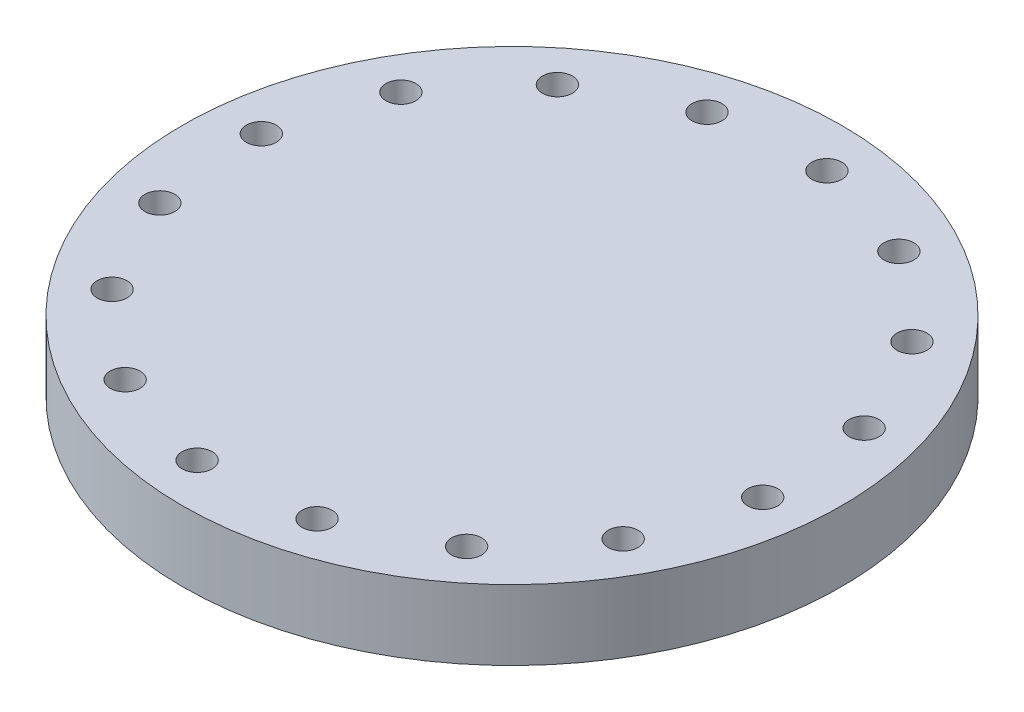
from build123d import *

# Parameters (mm, degrees)
SKETCH1_R           = 27.5
BOSS_EXTRUDE1_DEPTH = 2.925
CUT_EXTRUDE1_DEPTH  = 40.328393051


with BuildPart() as part:
    # Sketch1 → Boss-Extrude1 (new, symmetric)
    with BuildSketch(Plane(origin=(0, 0, 0), x_dir=(1, 0, 0), z_dir=(0, 1, 0))):
        with Locations(Location((0, 0, 0), (0, 0, 270))):
            Circle(SKETCH1_R)
    extrude(amount=BOSS_EXTRUDE1_DEPTH, both=True)

    # Sketch2 → Cut-Extrude1 (cut, through all)
    with BuildSketch(Plane.XZ.offset(2.925)):
        with BuildLine():
            ThreePointArc((22.019698731, -5.602620776), (21.872491194, -7.364247848), (23.634118266, -7.511455385))
            ThreePointArc((23.634118266, -7.511455385), (23.781325803, -5.749828313), (22.019698731, -5.602620776))
        make_face()
        with BuildLine():
            ThreePointArc((22.791373624, 3.631983723), (22.644166087, 1.87035665), (24.405793159, 1.723149114))
            ThreePointArc((24.405793159, 1.723149114), (24.553000696, 3.484776186), (22.791373624, 3.631983723))
        make_face()
        with BuildLine():
            ThreePointArc((17.772833946, -13.838975667), (17.625626409, -15.600602739), (19.387253481, -15.747810276))
            ThreePointArc((19.387253481, -15.747810276), (19.534461018, -13.986183203), (17.772833946, -13.838975667))
        make_face()
        with BuildLine():
            ThreePointArc((10.697325934, -19.82317058), (10.550118397, -21.584797652), (12.311745469, -21.732005189))
            ThreePointArc((12.311745469, -21.732005189), (12.458953006, -19.970378117), (10.697325934, -19.82317058))
        make_face()
        with BuildLine():
            ThreePointArc((1.87035665, -22.644166087), (1.723149114, -24.405793159), (3.484776186, -24.553000696))
            ThreePointArc((3.484776186, -24.553000696), (3.631983723, -22.791373624), (1.87035665, -22.644166087))
        make_face()
        with BuildLine():
            ThreePointArc((-7.364247848, -21.872491194), (-7.511455385, -23.634118266), (-5.749828313, -23.781325803))
            ThreePointArc((-5.749828313, -23.781325803), (-5.602620776, -22.019698731), (-7.364247848, -21.872491194))
        make_face()
        with BuildLine():
            ThreePointArc((-15.600602739, -17.625626409), (-15.747810276, -19.387253481), (-13.986183203, -19.534461018))
            ThreePointArc((-13.986183203, -19.534461018), (-13.838975667, -17.772833946), (-15.600602739, -17.625626409))
        make_face()
        with BuildLine():
            ThreePointArc((-21.584797652, -10.550118397), (-21.732005189, -12.311745469), (-19.970378117, -12.458953006))
            ThreePointArc((-19.970378117, -12.458953006), (-19.82317058, -10.697325934), (-21.584797652, -10.550118397))
        make_face()
        with BuildLine():
            ThreePointArc((-24.405793159, -1.723149114), (-24.553000696, -3.484776186), (-22.791373624, -3.631983723))
            ThreePointArc((-22.791373624, -3.631983723), (-22.644166087, -1.87035665), (-24.405793159, -1.723149114))
        make_face()
        with BuildLine():
            ThreePointArc((-23.634118266, 7.511455385), (-23.781325803, 5.749828313), (-22.019698731, 5.602620776))
            ThreePointArc((-22.019698731, 5.602620776), (-21.872491194, 7.364247848), (-23.634118266, 7.511455385))
        make_face()
        with BuildLine():
            ThreePointArc((-19.387253481, 15.747810276), (-19.534461018, 13.986183203), (-17.772833946, 13.838975667))
            ThreePointArc((-17.772833946, 13.838975667), (-17.625626409, 15.600602739), (-19.387253481, 15.747810276))
        make_face()
        with BuildLine():
            ThreePointArc((-12.311745469, 21.732005189), (-12.458953006, 19.970378117), (-10.697325934, 19.82317058))
            ThreePointArc((-10.697325934, 19.82317058), (-10.550118397, 21.584797652), (-12.311745469, 21.732005189))
        make_face()
        with BuildLine():
            ThreePointArc((-3.484776186, 24.553000696), (-3.631983723, 22.791373624), (-1.87035665, 22.644166087))
            ThreePointArc((-1.87035665, 22.644166087), (-1.723149114, 24.405793159), (-3.484776186, 24.553000696))
        make_face()
        with BuildLine():
            ThreePointArc((5.749828313, 23.781325803), (5.602620776, 22.019698731), (7.364247848, 21.872491194))
            ThreePointArc((7.364247848, 21.872491194), (7.511455385, 23.634118266), (5.749828313, 23.781325803))
        make_face()
        with BuildLine():
            ThreePointArc((19.970378117, 12.458953006), (19.82317058, 10.697325934), (21.584797652, 10.550118397))
            ThreePointArc((21.584797652, 10.550118397), (21.732005189, 12.311745469), (19.970378117, 12.458953006))
        make_face()
        with BuildLine():
            ThreePointArc((13.986183203, 19.534461018), (13.838975667, 17.772833946), (15.600602739, 17.625626409))
            ThreePointArc((15.600602739, 17.625626409), (15.747810276, 19.387253481), (13.986183203, 19.534461018))
        make_face()
    extrude(amount=-CUT_EXTRUDE1_DEPTH, mode=Mode.SUBTRACT)


solid = part.part
